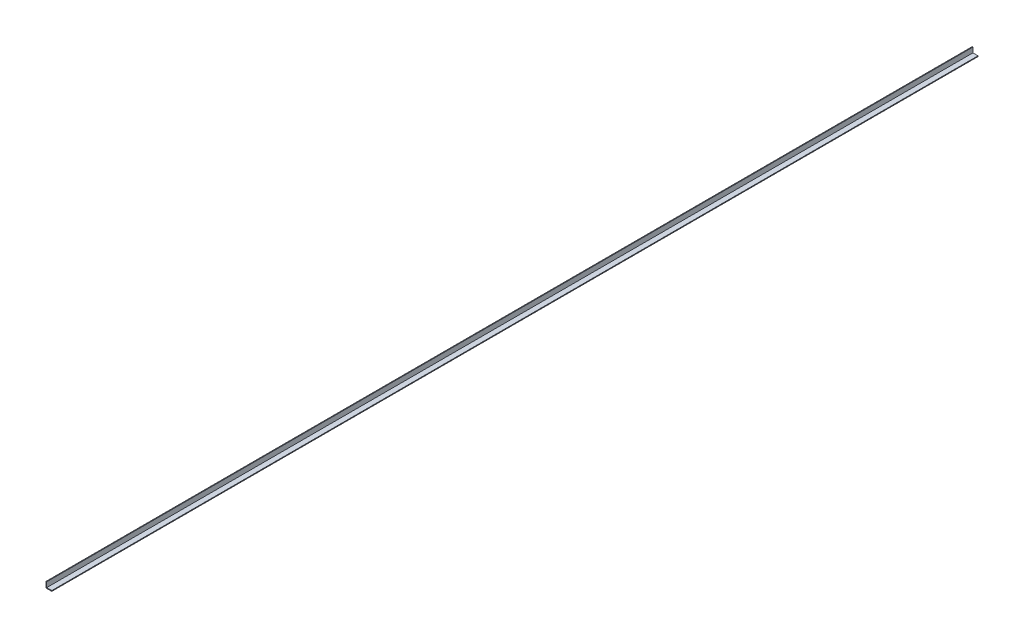
from build123d import *

# Parameters (mm, degrees)
SALIENTE_EXTRUIR1_DEPTH = 6100


with BuildPart() as part:
    # Croquis1 → Saliente-Extruir1 (new body)
    with BuildSketch(Plane.XY):
        Polygon((0, 38.1), (0, 0), (38.1, 0), (38.1, 4.76), (4.76, 4.76), (4.76, 38.1), align=None)
    extrude(amount=-SALIENTE_EXTRUIR1_DEPTH)


solid = part.part
